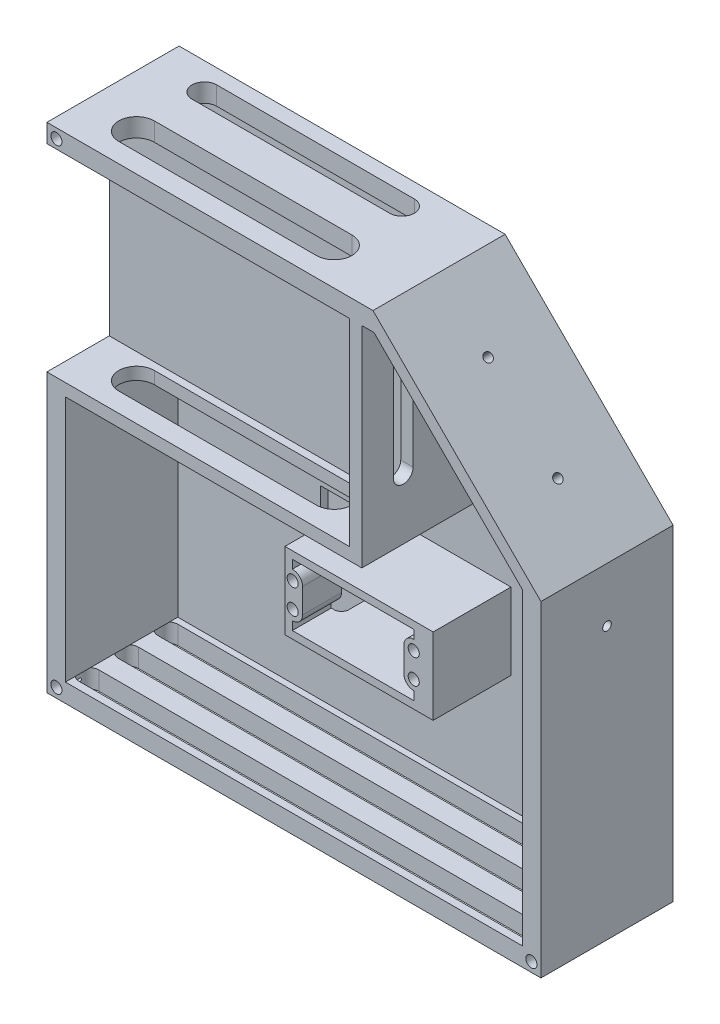
from build123d import *

# Parameters (mm, degrees)
BOSS_EXTRUDE1_DEPTH     = 8
SKETCH1_W               = 122.5
SKETCH1_H               = 80
BOSS_EXTRUDE1_2_DEPTH   = 8
BOSS_EXTRUDE2_DEPTH     = 53.5
CUT_EXTRUDE6_DEPTH      = 7.5
SKETCH2_W               = 60
SKETCH2_H               = 31
SKETCH2_R               = 2.25
BOSS_EXTRUDE3_DEPTH     = 31.5
CUT_EXTRUDE5_REACH      = 165.406
SKETCH8_W               = 15.75
SKETCH8_H               = 31
CUT_EXTRUDE8_START      = -3
CUT_EXTRUDE8_DEPTH      = 3
FILLET1_R               = 3
CUT_EXTRUDE1_DEPTH      = 122.5
CUT_EXTRUDE1_DEPTH_BACK = 15
SKETCH4_W               = 3
SKETCH4_H               = 87.5
BOSS_EXTRUDE5_DEPTH     = 122.5
SKETCH5_W               = 5
SKETCH5_H               = 80
CUT_EXTRUDE2_DEPTH      = 122.5
CUT_EXTRUDE3_DEPTH      = 15
CUT_EXTRUDE3_DEPTH_BACK = 92.5
SKETCH7_R               = 2.25
CUT_EXTRUDE4_DEPTH      = 13.5
CUT_EXTRUDE9_DEPTH      = 5
SKETCH13_R              = 1.75
CUT_EXTRUDE10_DEPTH     = 7.5


with BuildPart() as part:
    # Sketch1 → Boss-Extrude1 (new body)
    with BuildSketch(Plane.XY):
        Polygon((32.428932188, 92.5), (27.5, 92.5), (27.5, 7.5), (-92.5, 7.5), (-92.5, -92.5), (92.5, -92.5), (92.5, 32.428932188), align=None)
    extrude(amount=BOSS_EXTRUDE1_DEPTH)



with BuildPart() as body_2:
    # Sketch1 → Boss-Extrude1 2 (new body)
    with BuildSketch(Plane.XY):
        with Locations((-38.75, 52.5)):
            Rectangle(SKETCH1_W, SKETCH1_H)
    extrude(amount=BOSS_EXTRUDE1_2_DEPTH)


with BuildPart() as part_1:
    add(part.part)

    add(body_2.part)  # Boss-Extrude2 merges body 2
    # Sketch1<4> → Boss-Extrude2 (add)
    with BuildSketch(Plane.XY):
        Polygon((22.5, 92.5), (22.5, 12.5), (-100, 12.5), (-100, -100), (100, -100), (100, 32), (32, 100), (-100, 100), (-100, 92.5), align=None)
        Polygon((-92.5, 7.5), (27.5, 7.5), (27.5, 92.5), (32.428932188, 92.5), (92.5, 32.428932188), (92.5, -92.5), (-92.5, -92.5), align=None, mode=Mode.SUBTRACT)
    extrude(amount=BOSS_EXTRUDE2_DEPTH)

    # Sketch9 → Cut-Extrude6 (cut)
    with BuildSketch(Plane.XZ.offset(100)):
        with BuildLine():
            Line((-90, 42.466293919), (90, 42.466293919))
            ThreePointArc((90, 42.466293919), (94, 46.466293919), (90, 50.466293919))
            Line((90, 50.466293919), (-90, 50.466293919))
            ThreePointArc((-90, 50.466293919), (-94, 46.466293919), (-90, 42.466293919))
        make_face()
        with BuildLine():
            Line((-90, 26.466293919), (90, 26.466293919))
            ThreePointArc((90, 26.466293919), (94, 30.466293919), (90, 34.466293919))
            Line((90, 34.466293919), (-90, 34.466293919))
            ThreePointArc((-90, 34.466293919), (-94, 30.466293919), (-90, 26.466293919))
        make_face()
        with BuildLine():
            Line((-90, 10.466293919), (90, 10.466293919))
            ThreePointArc((90, 10.466293919), (94, 14.466293919), (90, 18.466293919))
            Line((90, 18.466293919), (-90, 18.466293919))
            ThreePointArc((-90, 18.466293919), (-94, 14.466293919), (-90, 10.466293919))
        make_face()
    extrude(amount=-CUT_EXTRUDE6_DEPTH, mode=Mode.SUBTRACT)

    # Sketch2 → Boss-Extrude3 (add)
    with BuildSketch(Plane.XY.offset(8)):
        with Locations((12.359091867, -30)):
            Rectangle(SKETCH2_W, SKETCH2_H)
        with BuildLine():
            ThreePointArc((-14.640908133, -38.997517342), (-11.721838066, -37.877814495), (-10.5, -35))
            Line((-10.5, -35), (-10.5, -25))
            ThreePointArc((-10.5, -25), (-11.721838066, -22.122185505), (-14.640908133, -21.002482658))
            Line((-14.640908133, -21.002482658), (-14.640908133, -17.5))
            Line((-14.640908133, -17.5), (34.640908133, -17.5))
            Line((34.640908133, -17.5), (34.640908133, -21.002482658))
            ThreePointArc((34.640908133, -21.002482658), (31.721838066, -22.122185505), (30.5, -25))
            Line((30.5, -25), (30.5, -35))
            ThreePointArc((30.5, -35), (31.721838066, -37.877814495), (34.640908133, -38.997517342))
            Line((34.640908133, -38.997517342), (34.640908133, -42.5))
            Line((34.640908133, -42.5), (-14.640908133, -42.5))
            Line((-14.640908133, -42.5), (-14.640908133, -38.997517342))
        make_face(mode=Mode.SUBTRACT)
        with Locations((-14.5, -25)):
            Circle(SKETCH2_R, mode=Mode.SUBTRACT)
        with Locations((-14.5, -35)):
            Circle(SKETCH2_R, mode=Mode.SUBTRACT)
        with Locations((34.5, -35)):
            Circle(SKETCH2_R, mode=Mode.SUBTRACT)
        with Locations((34.5, -25)):
            Circle(SKETCH2_R, mode=Mode.SUBTRACT)
    extrude(amount=BOSS_EXTRUDE3_DEPTH)

    # Cut-Extrude5: up to this face of the body (flat: up to its plane)
    cut_extrude5_end = Plane(part_1.part.faces().sort_by_distance((-10.5, -30, 23.75))[0])
    # Sketch8 → Cut-Extrude5 (cut, up to the picked face)
    with BuildSketch(Plane.ZY.offset(17.640908133), mode=Mode.PRIVATE) as cut_extrude5_sk1:
        with Locations((15.875, -30)):
            Rectangle(SKETCH8_W, SKETCH8_H)
    cut_extrude5_tool1 = split(extrude(cut_extrude5_sk1.sketch, amount=-CUT_EXTRUDE5_REACH, mode=Mode.PRIVATE), bisect_by=cut_extrude5_end, keep=Keep.BOTH, mode=Mode.PRIVATE)
    add(cut_extrude5_tool1.solids().sort_by(Axis((-17.640908, -30, 15.875), (1, 0, 0)))[0], mode=Mode.SUBTRACT)

    # Sketch10 → Cut-Extrude8 (cut)
    with BuildSketch(Plane.XY.offset(8).offset(CUT_EXTRUDE8_START)):
        with BuildLine():
            Line((34.640908133, -42.5), (34.640908133, -38.997517342))
            ThreePointArc((34.640908133, -38.997517342), (31.721838066, -37.877814495), (30.5, -35))
            Line((30.5, -35), (30.5, -25))
            ThreePointArc((30.5, -25), (31.721838066, -22.122185505), (34.640908133, -21.002482658))
            Line((34.640908133, -21.002482658), (34.640908133, -17.5))
            Line((34.640908133, -17.5), (-14.640908133, -17.5))
            Line((-14.640908133, -17.5), (-34.640908133, -17.5))
            Line((-34.640908133, -17.5), (-34.640908133, -42.5))
            Line((-34.640908133, -42.5), (-14.640908133, -42.5))
            Line((-14.640908133, -42.5), (34.640908133, -42.5))
        make_face()
    extrude(amount=CUT_EXTRUDE8_DEPTH, mode=Mode.SUBTRACT)

    # Fillet1
    fillet1_edges = [part_1.edges().sort_by_distance(p)[0] for p in [
        (-10.5, -44, 23.75),
        (-10.5, -16, 23.75),
    ]]
    fillet(fillet1_edges, radius=FILLET1_R)

    # Sketch3 → Cut-Extrude1 (cut, two sides: drawn at the far end of the back side and taken through both)
    with BuildSketch(Plane.ZY.offset(-22.5).offset(-CUT_EXTRUDE1_DEPTH_BACK)):
        with BuildLine():
            Line((14, 72.5), (14, 32.5))
            ThreePointArc((14, 32.5), (10, 28.5), (6, 32.5))
            Line((6, 32.5), (6, 72.5))
            ThreePointArc((6, 72.5), (10, 76.5), (14, 72.5))
        make_face()
        with BuildLine():
            Line((40.75, 72.5), (40.75, 32.5))
            ThreePointArc((40.75, 32.5), (36.75, 28.5), (32.75, 32.5))
            Line((32.75, 32.5), (32.75, 72.5))
            ThreePointArc((32.75, 72.5), (36.75, 76.5), (40.75, 72.5))
        make_face()
    extrude(amount=CUT_EXTRUDE1_DEPTH + CUT_EXTRUDE1_DEPTH_BACK, mode=Mode.SUBTRACT)

    # Sketch4 → Boss-Extrude5 (add)
    with BuildSketch(Plane.ZY.offset(-22.5)):
        with Locations((26.75, 56.25)):
            Rectangle(SKETCH4_W, SKETCH4_H)
    extrude(amount=BOSS_EXTRUDE5_DEPTH)

    # Sketch5 → Cut-Extrude2 (cut)
    with BuildSketch(Plane.ZY.offset(100)):
        with Locations((5.5, 52.5)):
            Rectangle(SKETCH5_W, SKETCH5_H)
    extrude(amount=-CUT_EXTRUDE2_DEPTH, mode=Mode.SUBTRACT)

    # Sketch6 → Cut-Extrude3 (cut, two sides: drawn at the far end of the back side and taken through both)
    with BuildSketch(Plane.XZ.offset(-7.5).offset(-CUT_EXTRUDE3_DEPTH_BACK)):
        with BuildLine():
            Line((-78.75, 31.25), (1.25, 31.25))
            ThreePointArc((1.25, 31.25), (8.455515357, 38.455515357), (1.25, 45.661030714))
            Line((1.25, 45.661030714), (-78.75, 45.661030714))
            ThreePointArc((-78.75, 45.661030714), (-85.955515357, 38.455515357), (-78.75, 31.25))
        make_face()
        with BuildLine():
            Line((-82.75, 8), (5.25, 8))
            ThreePointArc((5.25, 8), (5.722135955, 13.236067977), (1.25, 16))
            Line((1.25, 16), (-78.75, 16))
            ThreePointArc((-78.75, 16), (-83.222135955, 13.236067977), (-82.75, 8))
        make_face()
        with BuildLine():
            ThreePointArc((1.25, 6), (3.486067977, 6.527864045), (5.25, 8))
            Line((5.25, 8), (-82.75, 8))
            ThreePointArc((-82.75, 8), (-80.986067977, 6.527864045), (-78.75, 6))
            Line((-78.75, 6), (1.25, 6))
        make_face()
    extrude(amount=CUT_EXTRUDE3_DEPTH + CUT_EXTRUDE3_DEPTH_BACK, mode=Mode.SUBTRACT)

    # Sketch7 → Cut-Extrude4 (cut)
    with BuildSketch(Plane.XY.offset(53.5)):
        with Locations((-96.15, 96.15)):
            Circle(SKETCH7_R)
        with Locations((96.15, 96.15)):
            Circle(SKETCH7_R)
        with Locations((-96.15, -96.15)):
            Circle(SKETCH7_R)
        with Locations((96.15, -96.15)):
            Circle(SKETCH7_R)
    extrude(amount=-CUT_EXTRUDE4_DEPTH, mode=Mode.SUBTRACT)

    # Sketch11 → Cut-Extrude9 (cut)
    with BuildSketch(Plane(origin=(66, 66, 0), x_dir=(0, 0, -1), z_dir=(0.7071067811865488, 0.7071067811865462, 0))):
        with BuildLine():
            ThreePointArc((-25, -20), (-25.512563133, -18.762563133), (-26.75, -18.25))
            Line((-26.75, -18.25), (-26.75, -21.75))
            ThreePointArc((-26.75, -21.75), (-25.512563133, -21.237436867), (-25, -20))
        make_face()
        with BuildLine():
            Line((-26.75, -21.75), (-26.75, -18.25))
            ThreePointArc((-26.75, -18.25), (-28.5, -20), (-26.75, -21.75))
        make_face()
        with BuildLine():
            ThreePointArc((-25, 20), (-25.512563133, 21.237436867), (-26.75, 21.75))
            Line((-26.75, 21.75), (-26.75, 18.25))
            ThreePointArc((-26.75, 18.25), (-25.512563133, 18.762563133), (-25, 20))
        make_face()
        with BuildLine():
            Line((-26.75, 18.25), (-26.75, 21.75))
            ThreePointArc((-26.75, 21.75), (-28.5, 20), (-26.75, 18.25))
        make_face()
    extrude(amount=-CUT_EXTRUDE9_DEPTH, mode=Mode.SUBTRACT)

    # Sketch13 → Cut-Extrude10 (cut)
    with BuildSketch(Plane(origin=(100, 0, 0), x_dir=(0, 0, -1), z_dir=(1, 0, 0))):
        with Locations((-26.75, 10)):
            Circle(SKETCH13_R)
    extrude(amount=-CUT_EXTRUDE10_DEPTH, mode=Mode.SUBTRACT)


solid = part_1.part
